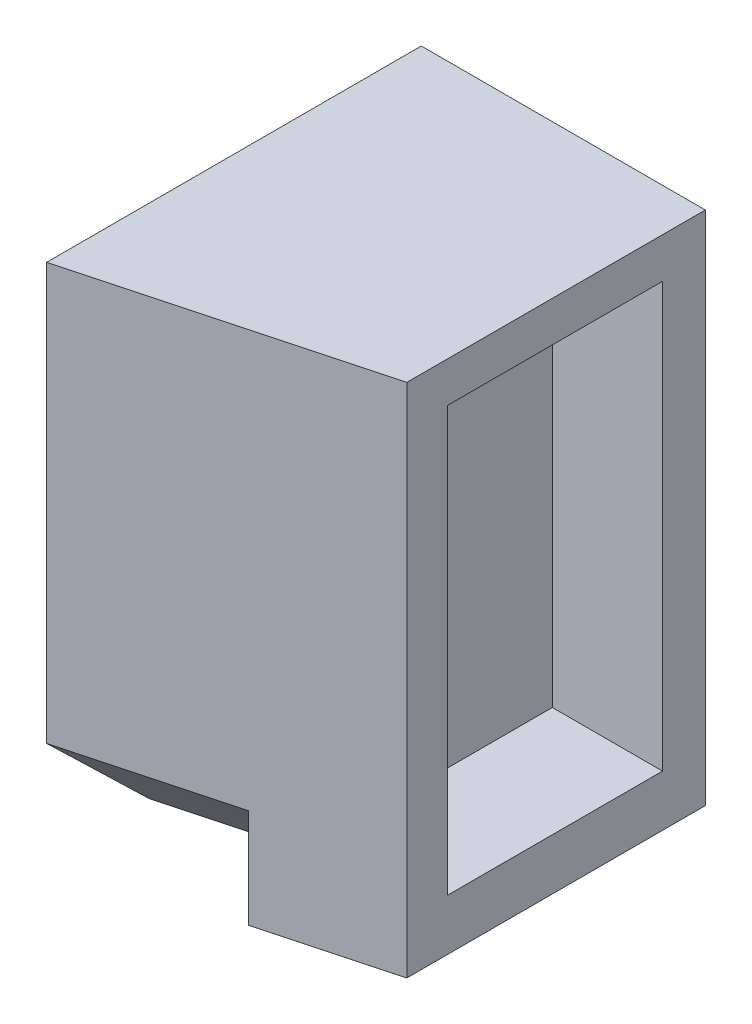
from build123d import *

# Parameters (mm, degrees)
BOSS_EXTRUDE1_DEPTH = 594.610278
SKETCH3_W           = 247.65
SKETCH3_H           = 488.95
CUT_EXTRUDE1_DEPTH  = 127
SKETCH4_W           = 200
SKETCH4_H           = 250
CUT_EXTRUDE2_DEPTH  = 100
SKETCH5_W           = 100
SKETCH5_H           = 100
CUT_EXTRUDE3_DEPTH  = 100
CUT_EXTRUDE4_DEPTH  = 172
CUT_EXTRUDE5_DEPTH  = 190


with BuildPart() as part:
    # Sketch2 → Boss-Extrude1 (new body)
    with BuildSketch(Plane(origin=(0, 0, 0), x_dir=(1, 0, 0), z_dir=(0, 1, 0))):
        Polygon((0, -431.8), (327.385580216, -344.077298168), (327.385580216, 0), (0, 0), align=None)
    extrude(amount=BOSS_EXTRUDE1_DEPTH)

    # Sketch3 → Cut-Extrude1 (cut)
    with BuildSketch(Plane(origin=(327.385580216, 0, 0), x_dir=(0, 0, -1), z_dir=(1, 0, 0))):
        with Locations((-173.171445322, 303.629475409)):
            Rectangle(SKETCH3_W, SKETCH3_H)
    extrude(amount=-CUT_EXTRUDE1_DEPTH, mode=Mode.SUBTRACT)

    # Sketch4 → Cut-Extrude2 (cut)
    with BuildSketch(Plane(origin=(0, 0, 0), x_dir=(0, -1, 0), z_dir=(1, 0, 0))):
        with Locations((-209.55, -215.9)):
            Rectangle(SKETCH4_W, SKETCH4_H)
    extrude(amount=CUT_EXTRUDE2_DEPTH, mode=Mode.SUBTRACT)

    # Sketch5 → Cut-Extrude3 (cut)
    with BuildSketch(Plane.ZY):
        with Locations((215.9, 488.315)):
            Rectangle(SKETCH5_W, SKETCH5_H)
    extrude(amount=-CUT_EXTRUDE3_DEPTH, mode=Mode.SUBTRACT)

    # Sketch6 → Cut-Extrude4 (cut)
    with BuildSketch(Plane.ZY):
        Polygon((0, 114.3), (114.3, 0), (0, 0), align=None)
    extrude(amount=-CUT_EXTRUDE4_DEPTH, mode=Mode.SUBTRACT)

    # Sketch7 → Cut-Extrude5 (cut)
    with BuildSketch(Plane(origin=(-107.95, 0, 28.925115323), x_dir=(0, 1, 0), z_dir=(0.9659258262890691, 0, -0.258819045102518))):
        Polygon((0, 417.086771792), (114.3, 417.086771792), (0, 302.786771792), align=None)
    extrude(amount=CUT_EXTRUDE5_DEPTH, mode=Mode.SUBTRACT)


solid = part.part
